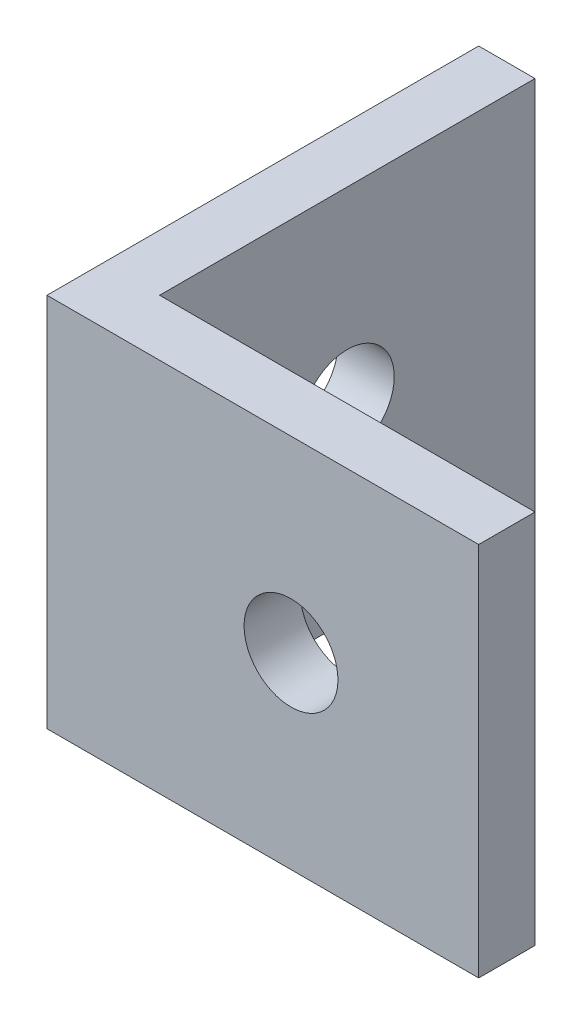
from build123d import *

# Parameters (mm, degrees)
SKETCH1_W           = 23
SKETCH1_H           = 20
BOSS_EXTRUDE1_DEPTH = 3
SKETCH2_W           = 3
SKETCH2_H           = 20
BOSS_EXTRUDE2_DEPTH = 20
CUT_EXTRUDE1_REACH  = 27.145
SKETCH3_R           = 2.5
CUT_EXTRUDE2_REACH  = 34.078
SKETCH4_R           = 2.5


with BuildPart() as part:
    # Sketch1 → Boss-Extrude1 (new body)
    with BuildSketch(Plane(origin=(0, 0, 0), x_dir=(0, 0, -1), z_dir=(1, 0, 0))):
        Rectangle(SKETCH1_W, SKETCH1_H)
    extrude(amount=BOSS_EXTRUDE1_DEPTH)

    # Sketch2 → Boss-Extrude2 (add)
    with BuildSketch(Plane(origin=(3, 0, 0), x_dir=(0, 0, -1), z_dir=(1, 0, 0))):
        with Locations((-10, 0)):
            Rectangle(SKETCH2_W, SKETCH2_H)
    extrude(amount=BOSS_EXTRUDE2_DEPTH)

    # Sketch3 → Cut-Extrude1 (cut, up to next)
    with BuildSketch(Plane(origin=(3, 0, 0), x_dir=(0, 0, -1), z_dir=(1, 0, 0)), mode=Mode.PRIVATE) as cut_extrude1_sk1:
        with Locations((1.5, 0)):
            Circle(SKETCH3_R)
    cut_extrude1_tool1 = extrude(cut_extrude1_sk1.sketch, amount=-CUT_EXTRUDE1_REACH, mode=Mode.PRIVATE) & part.part
    add(cut_extrude1_tool1.solids().sort_by_distance((3, 0, -1.5))[0], mode=Mode.SUBTRACT)

    # Sketch4 → Cut-Extrude2 (cut, up to next)
    with BuildSketch(Plane(origin=(0, 0, 8.5), x_dir=(-1, 0, 0), z_dir=(0, 0, -1)), mode=Mode.PRIVATE) as cut_extrude2_sk1:
        with Locations(Location((-13, 0, 0), (0, 0, 90))):
            Circle(SKETCH4_R)
    cut_extrude2_tool1 = extrude(cut_extrude2_sk1.sketch, amount=-CUT_EXTRUDE2_REACH, mode=Mode.PRIVATE) & part.part
    add(cut_extrude2_tool1.solids().sort_by_distance((13, 0, 8.5))[0], mode=Mode.SUBTRACT)


solid = part.part
